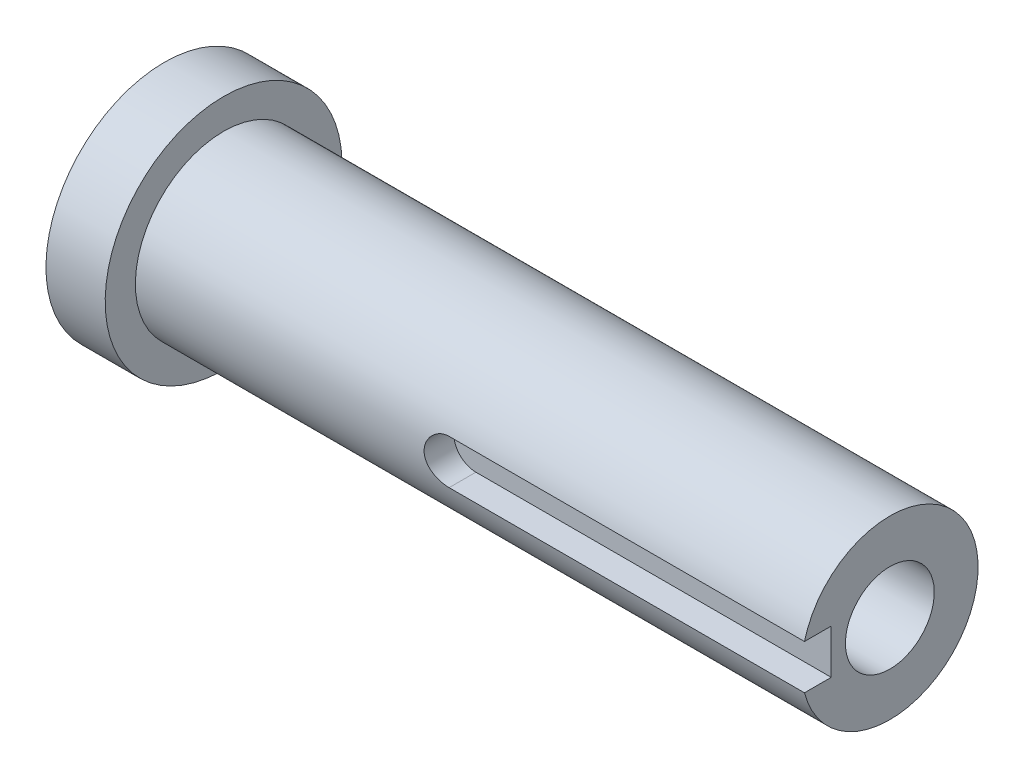
from build123d import *

# Parameters (mm, degrees)
CUT_EXTRUDE1_DEPTH = 6.35
SKETCH3_R          = 9.525
CUT_EXTRUDE2_DEPTH = 160.668095298


with BuildPart() as part:
    # Sketch1 → Revolve1 (revolve)
    with BuildSketch(Plane.XY):
        Polygon((155.575, 0), (0, 0), (0, 25.4), (12.7, 25.4), (12.7, 18.923), (155.575, 18.923), align=None)
    revolve(axis=Axis((155.575, 0, 0), (-1, 0, 0)))

    # Sketch2 → Cut-Extrude1 (cut)
    with BuildSketch(Plane.XY.offset(18.923)):
        with BuildLine():
            Line((74.6125, 0), (155.575, 0))
            Line((155.575, 0), (155.575, 4.7625))
            Line((155.575, 4.7625), (79.375, 4.7625))
            ThreePointArc((79.375, 4.7625), (76.007403955, 3.367596045), (74.6125, 0))
        make_face()
        with BuildLine():
            Line((155.575, -4.7625), (155.575, 0))
            Line((155.575, 0), (74.6125, 0))
            ThreePointArc((74.6125, 0), (76.007403955, -3.367596045), (79.375, -4.7625))
            Line((79.375, -4.7625), (155.575, -4.7625))
        make_face()
    extrude(amount=-CUT_EXTRUDE1_DEPTH, mode=Mode.SUBTRACT)

    # Sketch3 → Cut-Extrude2 (cut, through all)
    with BuildSketch(Plane.ZY):
        with Locations(Location((0, 0, 0), (0, 0, 270))):
            Circle(SKETCH3_R)
    extrude(amount=-CUT_EXTRUDE2_DEPTH, mode=Mode.SUBTRACT)


solid = part.part
